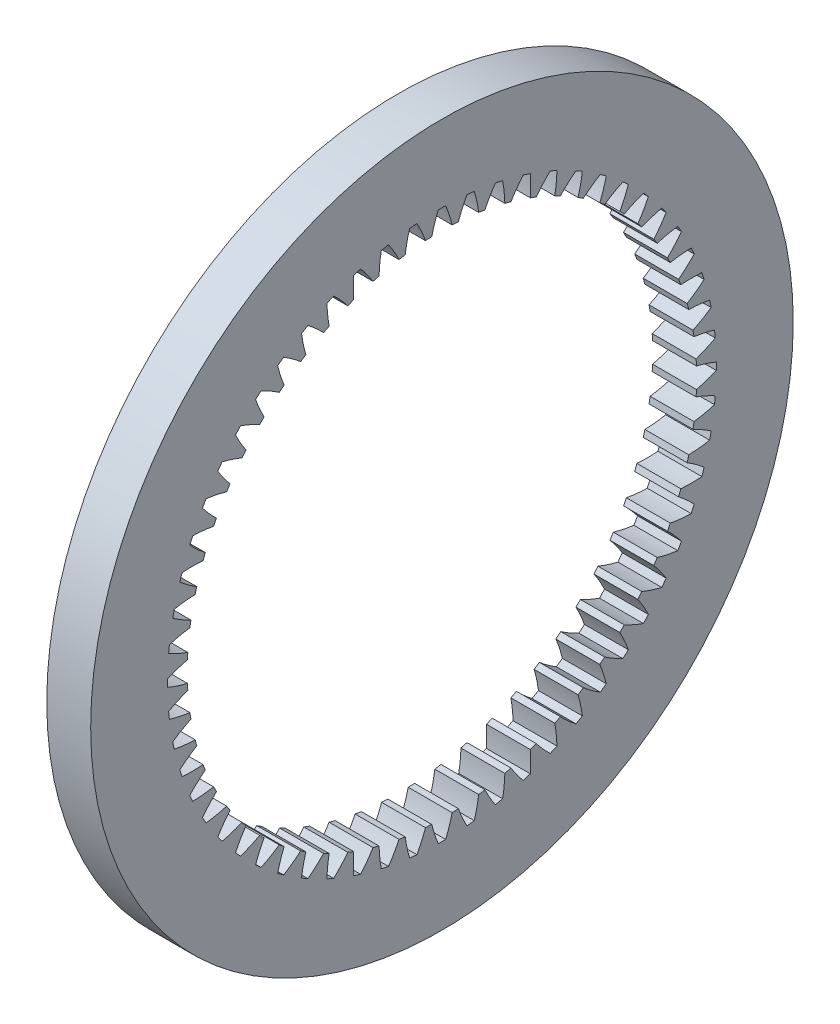
from build123d import *

# Parameters (mm, degrees)
BASPROSKE_W     = 5
BASPROSKE_H     = 11
TOOTHCUT_DEPTH  = 57.789083458
TEETHCUTS_COUNT = 60
TEETHCUTS_ANGLE = 354


with BuildPart() as part:
    # BasProSke → Base-Revolve (revolve)
    with BuildSketch(Plane(origin=(0, 0, 0), x_dir=(1, 0, 0), z_dir=(0, 1, 0)), mode=Mode.PRIVATE) as base_revolve_sk:
        with Locations((2.5, 34.5)):
            Rectangle(BASPROSKE_W, BASPROSKE_H)
    revolve(base_revolve_sk.sketch.rotate(Axis((-10, 0, 0), (1, 0, 0)), 180), axis=Axis((-10, 0, 0), (1, 0, 0)))

    # TooCutSke → ToothCut (cut, through all)
    with BuildSketch(Plane(origin=(0, 0, 0), x_dir=(0, 0, -1), z_dir=(1, 0, 0))):
        with BuildLine():
            ThreePointArc((1.166899632, 28.951093078), (0.839396859, 30.114715411), (0.419258803, 31.248187516))
            ThreePointArc((0.419258803, 31.248187516), (0, 31.251), (-0.419258803, 31.248187516))
            ThreePointArc((-0.419258803, 31.248187516), (-0.839396859, 30.114715411), (-1.166899632, 28.951093078))
            ThreePointArc((-1.166899632, 28.951093078), (0, 28.9746), (1.166899632, 28.951093078))
        make_face()
    toothcut = extrude(amount=TOOTHCUT_DEPTH, mode=Mode.SUBTRACT)

    # TeethCuts: ToothCut ×60 about axis
    teethcuts_axis = Axis((-10, 0, 0), (1, 0, 0))
    for i in range(1, TEETHCUTS_COUNT):
        add(toothcut.rotate(teethcuts_axis, i * TEETHCUTS_ANGLE / (TEETHCUTS_COUNT - 1)), mode=Mode.SUBTRACT)


solid = part.part
